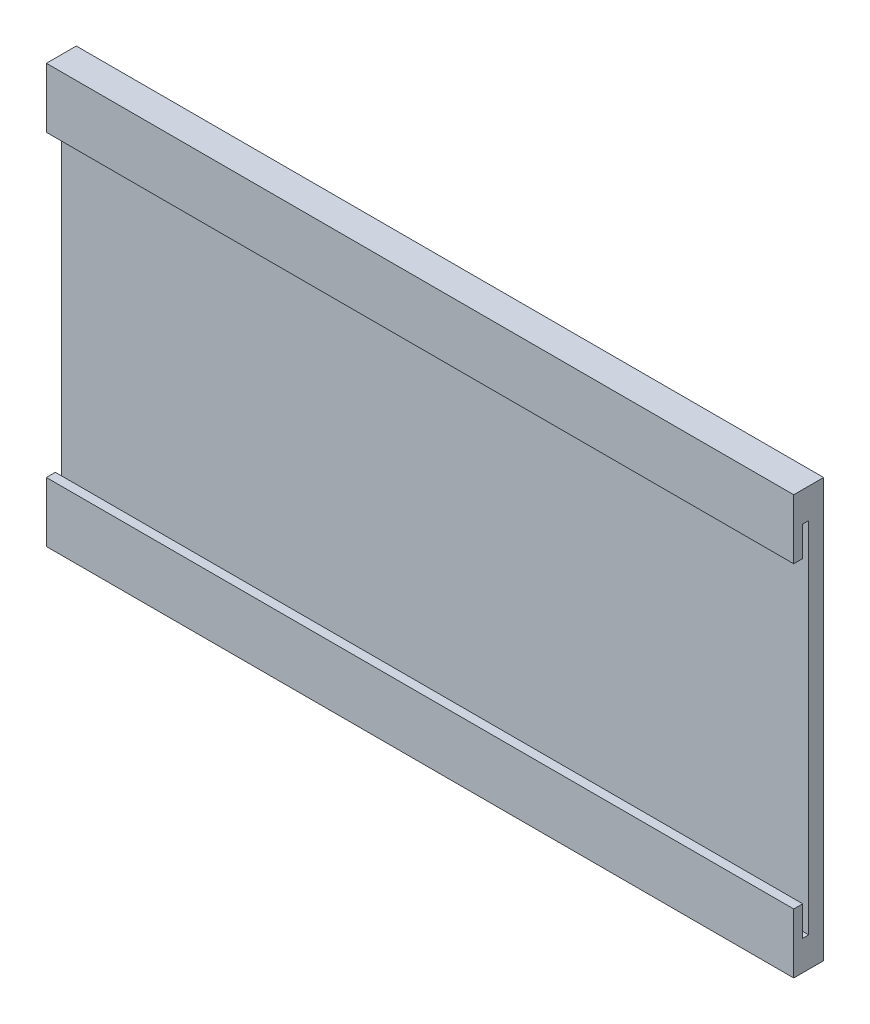
from build123d import *

# Parameters (mm, degrees)
BOSS_EXTRUDE1_DEPTH      = 5
BOSS_EXTRUDE1_DEPTH_BACK = 5
SKETCH1_W                = 250
SKETCH1_H                = 140
SKETCH1_3_W              = 250
SKETCH1_3_H              = 100
CUT_EXTRUDE1_DEPTH       = 260.663243452
SKETCH1_4_W              = 250
SKETCH1_4_H              = 10
CUT_EXTRUDE2_DEPTH       = 2


with BuildPart() as part:
    # Sketch1 → Boss-Extrude1 (new, two sides: drawn at the far end of the back side and taken through both)
    with BuildSketch(Plane.XY.offset(-BOSS_EXTRUDE1_DEPTH_BACK)):
        with Locations((125, 0)):
            Rectangle(SKETCH1_W, SKETCH1_H)
    extrude(amount=BOSS_EXTRUDE1_DEPTH + BOSS_EXTRUDE1_DEPTH_BACK)

    # Sketch1<3> → Cut-Extrude1 (cut, through all)
    with BuildSketch(Plane.XY):
        with Locations((125, 0)):
            Rectangle(SKETCH1_3_W, SKETCH1_3_H)
    extrude(amount=CUT_EXTRUDE1_DEPTH, mode=Mode.SUBTRACT)

    # Sketch1<4> → Cut-Extrude2 (cut)
    with BuildSketch(Plane.XY):
        with Locations((125, 55)):
            Rectangle(SKETCH1_4_W, SKETCH1_4_H)
        with Locations((125, -55)):
            Rectangle(SKETCH1_4_W, SKETCH1_4_H)
    extrude(amount=CUT_EXTRUDE2_DEPTH, mode=Mode.SUBTRACT)


solid = part.part
